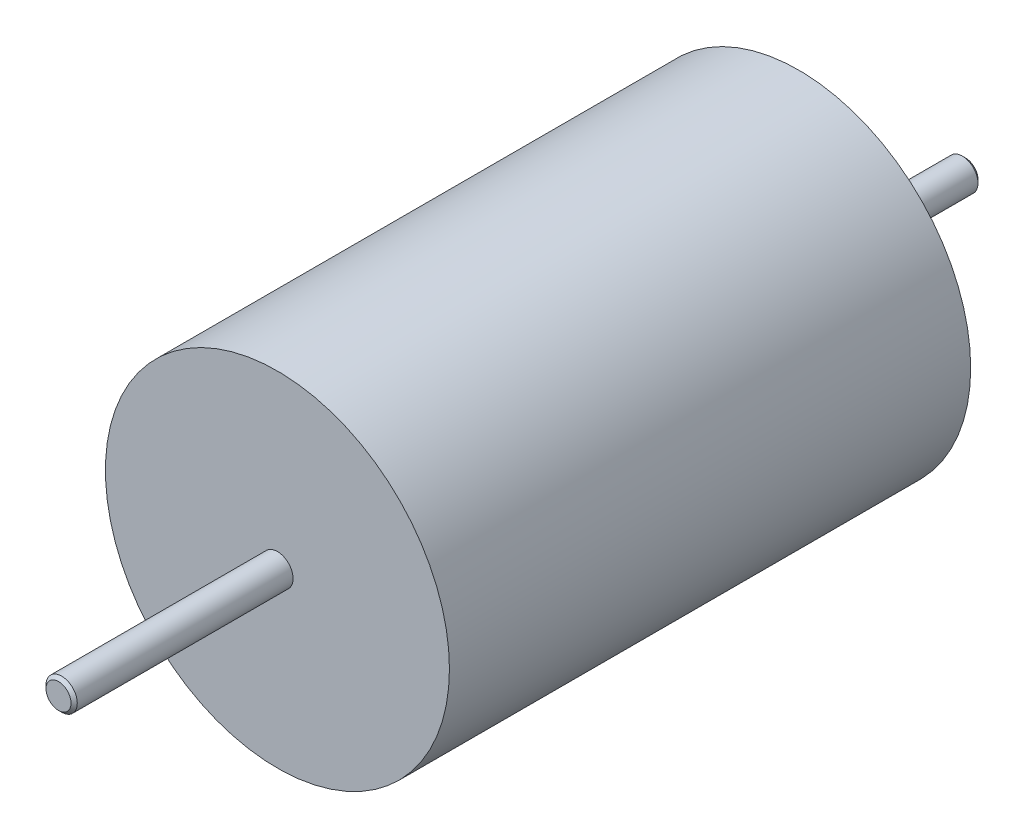
from build123d import *

# Parameters (mm, degrees)
SKETCH1_R           = 1.5
BOSS_EXTRUDE1_DEPTH = 43.5
SKETCH4_R           = 16.5
SKETCH4_R_2         = 1.5
BOSS_EXTRUDE2_DEPTH = 50
CHAMFER1_SIZE       = 0.3


with BuildPart() as part:
    # Sketch1 → Boss-Extrude1 (new, symmetric)
    with BuildSketch(Plane.XY):
        Circle(SKETCH1_R)
    extrude(amount=BOSS_EXTRUDE1_DEPTH, both=True)

    # Sketch4 → Boss-Extrude2 (add)
    with BuildSketch(Plane.XY.offset(22.5)):
        Circle(SKETCH4_R)
        Circle(SKETCH4_R_2, mode=Mode.SUBTRACT)
    extrude(amount=-BOSS_EXTRUDE2_DEPTH)

    # Chamfer1
    chamfer1_edges = [part.edges().sort_by_distance(p)[0] for p in [
        (-1.5, 0, -43.5),
        (-1.5, 0, 43.5),
    ]]
    chamfer(chamfer1_edges, length=CHAMFER1_SIZE)


solid = part.part
